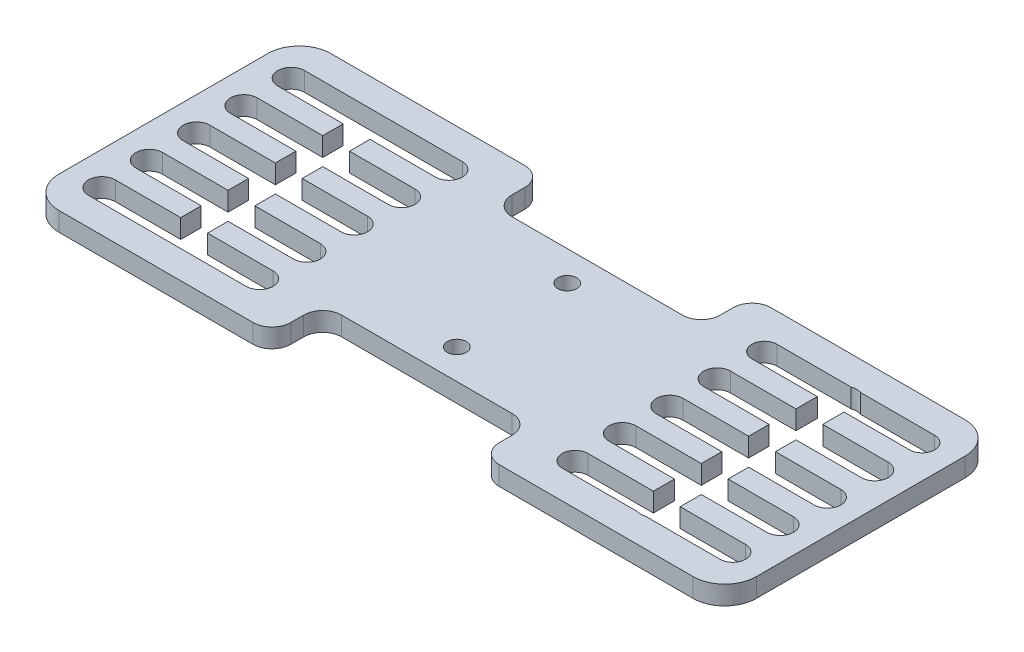
from build123d import *

# Parameters (mm, degrees)
CROQUIS1_R              = 3
SALIENTE_EXTRUIR1_DEPTH = 6


with BuildPart() as part:
    # Croquis1 → Saliente-Extruir1 (new body)
    with BuildSketch(Plane(origin=(0, 0, 0), x_dir=(1, 0, 0), z_dir=(0, 1, 0))):
        with BuildLine():
            Line((39.015376651, -43.078821925), (100.511897923, -43.078821925))
            ThreePointArc((100.511897923, -43.078821925), (107.582965735, -40.149889737), (110.511897923, -33.078821925))
            Line((110.511897923, -33.078821925), (110.511897923, 33.078821925))
            ThreePointArc((110.511897923, 33.078821925), (107.582965735, 40.149889737), (100.511897923, 43.078821925))
            Line((100.511897923, 43.078821925), (39.015376651, 43.078821925))
            ThreePointArc((39.015376651, 43.078821925), (34.772735964, 41.321462613), (33.015376651, 37.078821925))
            Line((33.015376651, 37.078821925), (33.015376651, 33))
            ThreePointArc((33.015376651, 33), (31.258017338, 28.757359313), (27.015376651, 27))
            Line((27.015376651, 27), (-27.015376651, 27))
            ThreePointArc((-27.015376651, 27), (-31.258017338, 28.757359313), (-33.015376651, 33))
            Line((-33.015376651, 33), (-33.015376651, 37.078821925))
            ThreePointArc((-33.015376651, 37.078821925), (-34.772735964, 41.321462613), (-39.015376651, 43.078821925))
            Line((-39.015376651, 43.078821925), (-100.511897923, 43.078821925))
            ThreePointArc((-100.511897923, 43.078821925), (-107.582965735, 40.149889737), (-110.511897923, 33.078821925))
            Line((-110.511897923, 33.078821925), (-110.511897923, -33.078821925))
            ThreePointArc((-110.511897923, -33.078821925), (-107.582965735, -40.149889737), (-100.511897923, -43.078821925))
            Line((-100.511897923, -43.078821925), (-39.015376651, -43.078821925))
            ThreePointArc((-39.015376651, -43.078821925), (-34.772735964, -41.321462613), (-33.015376651, -37.078821925))
            Line((-33.015376651, -37.078821925), (-33.015376651, -33))
            ThreePointArc((-33.015376651, -33), (-31.258017338, -28.757359313), (-27.015376651, -27))
            Line((-27.015376651, -27), (27.015376651, -27))
            ThreePointArc((27.015376651, -27), (31.258017338, -28.757359313), (33.015376651, -33))
            Line((33.015376651, -33), (33.015376651, -37.078821925))
            ThreePointArc((33.015376651, -37.078821925), (34.772735964, -41.321462613), (39.015376651, -43.078821925))
        make_face()
        with BuildLine():
            Line((-100, -25.75), (-79.25, -25.75))
            Line((-79.25, -25.75), (-79.25, -19.25))
            Line((-79.25, -19.25), (-100, -19.25))
            ThreePointArc((-100, -19.25), (-104.25, -15), (-100, -10.75))
            Line((-100, -10.75), (-79.25, -10.75))
            Line((-79.25, -10.75), (-79.25, -4.25))
            Line((-79.25, -4.25), (-100, -4.25))
            ThreePointArc((-100, -4.25), (-104.25, 0), (-100, 4.25))
            Line((-100, 4.25), (-79.25, 4.25))
            Line((-79.25, 4.25), (-79.25, 10.75))
            Line((-79.25, 10.75), (-100, 10.75))
            ThreePointArc((-100, 10.75), (-104.25, 15), (-100, 19.25))
            Line((-100, 19.25), (-79.25, 19.25))
            Line((-79.25, 19.25), (-79.25, 25.75))
            Line((-79.25, 25.75), (-100, 25.75))
            ThreePointArc((-100, 25.75), (-104.25, 30), (-100, 34.25))
            Line((-100, 34.25), (-75, 34.25))
            Line((-75, 34.25), (-50, 34.25))
            ThreePointArc((-50, 34.25), (-45.75, 30), (-50, 25.75))
            Line((-50, 25.75), (-70.75, 25.75))
            Line((-70.75, 25.75), (-70.75, 19.25))
            Line((-70.75, 19.25), (-50, 19.25))
            ThreePointArc((-50, 19.25), (-45.75, 15), (-50, 10.75))
            Line((-50, 10.75), (-70.75, 10.75))
            Line((-70.75, 10.75), (-70.75, 4.25))
            Line((-70.75, 4.25), (-50, 4.25))
            ThreePointArc((-50, 4.25), (-45.75, 0), (-50, -4.25))
            Line((-50, -4.25), (-70.75, -4.25))
            Line((-70.75, -4.25), (-70.75, -10.75))
            Line((-70.75, -10.75), (-50, -10.75))
            ThreePointArc((-50, -10.75), (-45.75, -15), (-50, -19.25))
            Line((-50, -19.25), (-70.75, -19.25))
            Line((-70.75, -19.25), (-70.75, -25.75))
            Line((-70.75, -25.75), (-50, -25.75))
            ThreePointArc((-50, -25.75), (-45.75, -30), (-50, -34.25))
            Line((-50, -34.25), (-75, -34.25))
            Line((-75, -34.25), (-100, -34.25))
            ThreePointArc((-100, -34.25), (-104.25, -30), (-100, -25.75))
        make_face(mode=Mode.SUBTRACT)
        with Locations(Location((0, -17.5, 0), (0, 0, 270))):
            Circle(CROQUIS1_R, mode=Mode.SUBTRACT)
        with BuildLine():
            Line((79.25, -19.25), (79.25, -25.9432425))
            Line((79.25, -25.9432425), (100, -25.9432425))
            ThreePointArc((100, -25.9432425), (104.0567575, -30), (100, -34.0567575))
            Line((100, -34.0567575), (76.266972211, -34.0567575))
            ThreePointArc((76.266972211, -34.0567575), (75, -34.25), (73.733027789, -34.0567575))
            Line((73.733027789, -34.0567575), (50, -34.0567575))
            ThreePointArc((50, -34.0567575), (45.9432425, -30), (50, -25.9432425))
            Line((50, -25.9432425), (70.75, -25.9432425))
            Line((70.75, -25.9432425), (70.75, -19.25))
            Line((70.75, -19.25), (50, -19.25))
            ThreePointArc((50, -19.25), (45.75, -15), (50, -10.75))
            Line((50, -10.75), (70.75, -10.75))
            Line((70.75, -10.75), (70.75, -4.25))
            Line((70.75, -4.25), (50, -4.25))
            ThreePointArc((50, -4.25), (45.75, 0), (50, 4.25))
            Line((50, 4.25), (70.75, 4.25))
            Line((70.75, 4.25), (70.75, 10.75))
            Line((70.75, 10.75), (50, 10.75))
            ThreePointArc((50, 10.75), (45.75, 15), (50, 19.25))
            Line((50, 19.25), (70.75, 19.25))
            Line((70.75, 19.25), (70.75, 26.012157078))
            Line((70.75, 26.012157078), (50, 26.012157078))
            ThreePointArc((50, 26.012157078), (46.012157078, 30), (50, 33.987842922))
            Line((50, 33.987842922), (73.530439238, 33.987842922))
            ThreePointArc((73.530439238, 33.987842922), (75, 34.25), (76.469560762, 33.987842922))
            Line((76.469560762, 33.987842922), (100, 33.987842922))
            ThreePointArc((100, 33.987842922), (103.987842922, 30), (100, 26.012157078))
            Line((100, 26.012157078), (79.25, 26.012157078))
            Line((79.25, 26.012157078), (79.25, 19.25))
            Line((79.25, 19.25), (100, 19.25))
            ThreePointArc((100, 19.25), (104.25, 15), (100, 10.75))
            Line((100, 10.75), (79.25, 10.75))
            Line((79.25, 10.75), (79.25, 4.25))
            Line((79.25, 4.25), (100, 4.25))
            ThreePointArc((100, 4.25), (104.25, 0), (100, -4.25))
            Line((100, -4.25), (79.25, -4.25))
            Line((79.25, -4.25), (79.25, -10.75))
            Line((79.25, -10.75), (100, -10.75))
            ThreePointArc((100, -10.75), (104.25, -15), (100, -19.25))
            Line((100, -19.25), (79.25, -19.25))
        make_face(mode=Mode.SUBTRACT)
        with Locations(Location((0, 17.5, 0), (0, 0, 270))):
            Circle(CROQUIS1_R, mode=Mode.SUBTRACT)
    extrude(amount=SALIENTE_EXTRUIR1_DEPTH)


solid = part.part
